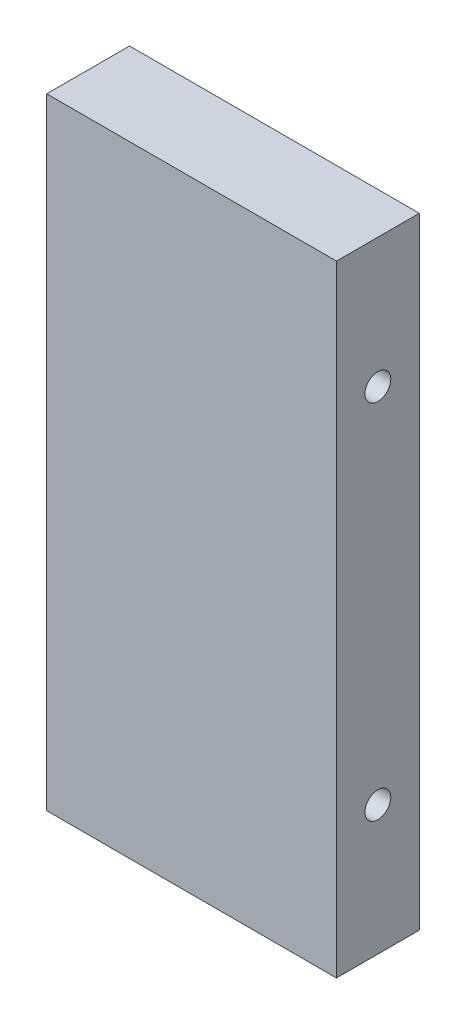
from build123d import *

# Parameters (mm, degrees)
SKETCH_1_W      = 28
SKETCH_1_H      = 60
EXTRUDE_1_DEPTH = 8
M3X0_5_1_D      = 2.5
M3X0_5_1_DEPTH  = 7.5
M3X0_5_1_TIP    = 0.751075774
M3X0_5_2_D      = 2.5
M3X0_5_2_DEPTH  = 7.5
M3X0_5_2_TIP    = 0.751075774


with BuildPart() as part:
    # ｽｹｯﾁ1 → ﾎﾞｽ - 押し出し1 (new body)
    with BuildSketch(Plane.XY):
        with Locations((14, 30)):
            Rectangle(SKETCH_1_W, SKETCH_1_H)
    extrude(amount=EXTRUDE_1_DEPTH)

    # M3x0.5 ねじ穴1
    with Locations(Plane(origin=(0, 47.5, 4), x_dir=(0, 0, -1), z_dir=(-1, 0, 0))):
        with Locations((0, 0), (0, 35)):
            Hole(M3X0_5_1_D / 2, depth=M3X0_5_1_DEPTH)
            with Locations((0, 0, -(M3X0_5_1_DEPTH + M3X0_5_1_TIP / 2))):  # 118° drill point
                Cone(0, M3X0_5_1_D / 2, M3X0_5_1_TIP, mode=Mode.SUBTRACT)

    # M3x0.5 ねじ穴2
    with Locations(Plane(origin=(28, 47.5, 4), x_dir=(0, 0, 1), z_dir=(1, 0, 0))):
        with Locations((0, 0), (0, 35)):
            Hole(M3X0_5_2_D / 2, depth=M3X0_5_2_DEPTH)
            with Locations((0, 0, -(M3X0_5_2_DEPTH + M3X0_5_2_TIP / 2))):  # 118° drill point
                Cone(0, M3X0_5_2_D / 2, M3X0_5_2_TIP, mode=Mode.SUBTRACT)


solid = part.part
